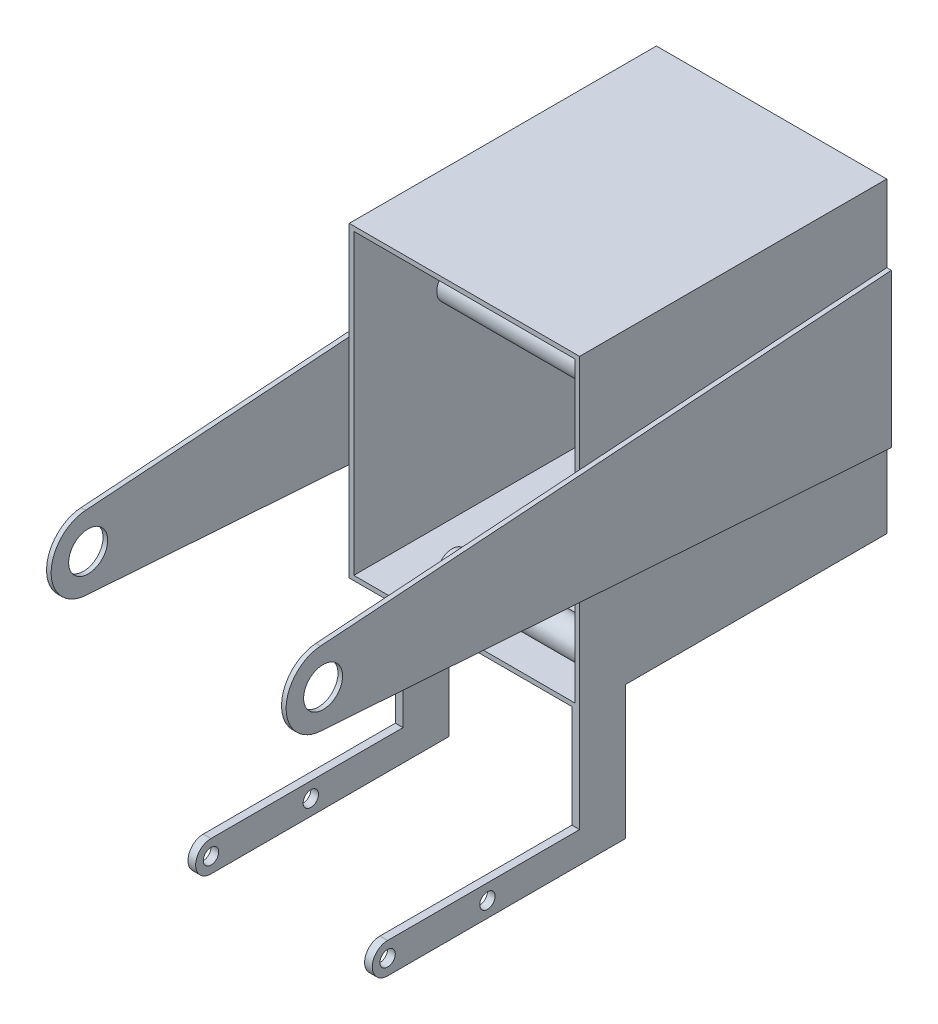
from build123d import *

# Parameters (mm, degrees)
CROQUIS1_W              = 150
CROQUIS1_H              = 200
SALIENTE_EXTRUIR1_DEPTH = 200
VACIADO1_T              = -3
CROQUIS2_R              = 10
SALIENTE_EXTRUIR2_DEPTH = 100
CROQUIS3_R              = 12.7
SALIENTE_EXTRUIR3_DEPTH = 3
CROQUIS6_R              = 5
SALIENTE_EXTRUIR4_DEPTH = 5
SALIENTE_EXTRUIR5_START = -5
CROQUIS8_R              = 5
SALIENTE_EXTRUIR5_DEPTH = 5


with BuildPart() as part:
    # Croquis1 → Saliente-Extruir1 (new body)
    with BuildSketch(Plane.XY):
        with Locations((75, 100)):
            Rectangle(CROQUIS1_W, CROQUIS1_H)
    extrude(amount=SALIENTE_EXTRUIR1_DEPTH)

    # Vaciado1
    vaciado1_openings = [part.faces().sort_by_distance(p)[0] for p in [
        (75, 100, 200),
    ]]
    offset(amount=VACIADO1_T, openings=vaciado1_openings, kind=Kind.INTERSECTION)

    # Croquis2 → Saliente-Extruir2 (add)
    with BuildSketch(Plane.ZY.offset(-147)):
        with Locations((33, 100)):
            Circle(CROQUIS2_R)
        with Locations((180, 180)):
            Circle(CROQUIS2_R)
        with Locations(Location((180, 20, 0), (0, 0, 180))):
            Circle(CROQUIS2_R)
    extrude(amount=SALIENTE_EXTRUIR2_DEPTH)

    # Croquis3 → Saliente-Extruir3 (add)
    with BuildSketch(Plane(origin=(150, 0, 0), x_dir=(0, 0, -1), z_dir=(1, 0, 0))):
        with BuildLine():
            Line((-371.678920241, 124.009678041), (0, 150))
            Line((0, 150), (0, 50))
            Line((0, 50), (-371.678920241, 75.990321959))
            ThreePointArc((-371.678920241, 75.990321959), (-394.068307228, 100), (-371.678920241, 124.009678041))
        make_face()
        with Locations((-370, 100)):
            Circle(CROQUIS3_R, mode=Mode.SUBTRACT)
    saliente_extruir3 = extrude(amount=SALIENTE_EXTRUIR3_DEPTH)

    # Simetría1: Saliente-Extruir3 across plane
    add(saliente_extruir3.mirror(Plane(origin=(75, 0, 0), x_dir=(0, 0, 1), z_dir=(1, 0, 0))))

    # Croquis6 → Saliente-Extruir4 (add)
    with BuildSketch(Plane(origin=(30, 0, 0), x_dir=(0, 0, -1), z_dir=(1, 0, 0))):
        with BuildLine():
            Line((-200, 0), (-200, -66.865061558))
            Line((-200, -66.865061558), (-325, -66.865061558))
            ThreePointArc((-325, -66.865061558), (-335, -76.865061558), (-325, -86.865061558))
            Line((-325, -86.865061558), (-170, -86.865061558))
            Line((-170, -86.865061558), (-170, 0))
            Line((-170, 0), (-200, 0))
        make_face()
        with Locations((-325, -76.865061558)):
            Circle(CROQUIS6_R, mode=Mode.SUBTRACT)
        with Locations((-260, -76.865061558)):
            Circle(CROQUIS6_R, mode=Mode.SUBTRACT)
    extrude(amount=SALIENTE_EXTRUIR4_DEPTH)

    # Croquis8 → Saliente-Extruir5 (add)
    with BuildSketch(Plane(origin=(150, 0, 0), x_dir=(0, 0, -1), z_dir=(1, 0, 0)).offset(SALIENTE_EXTRUIR5_START)):
        with BuildLine():
            Line((-200, -66.865061558), (-325, -66.865061558))
            ThreePointArc((-325, -66.865061558), (-335, -76.865061558), (-325, -86.865061558))
            Line((-325, -86.865061558), (-170, -86.865061558))
            Line((-170, -86.865061558), (-170, 0))
            Line((-170, 0), (-200, 0))
            Line((-200, 0), (-200, -66.865061558))
        make_face()
        with Locations((-260, -76.865061558)):
            Circle(CROQUIS8_R, mode=Mode.SUBTRACT)
        with Locations((-325, -76.865061558)):
            Circle(CROQUIS8_R, mode=Mode.SUBTRACT)
    extrude(amount=SALIENTE_EXTRUIR5_DEPTH)


solid = part.part
